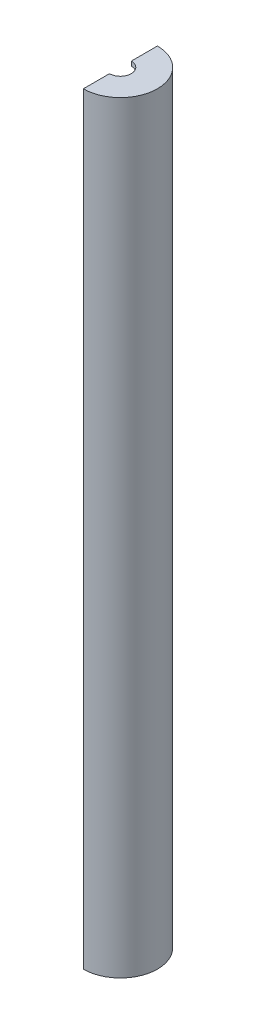
from build123d import *

# Parameters (mm, degrees)
EXTRUDE_1_DEPTH = 350
EXTRUDE_START   = -2
EXTRUDE_2_DEPTH = 2
EXTRUDE_3_DEPTH = 2


with BuildPart() as part:
    # 草图1 → 凸台-拉伸1 (new body)
    with BuildSketch(Plane(origin=(0, 0, 0), x_dir=(1, 0, 0), z_dir=(0, 1, 0))):
        with BuildLine():
            Line((0, 17), (0, 15))
            ThreePointArc((0, 15), (15, 0), (0, -15))
            Line((0, -15), (0, -17))
            ThreePointArc((0, -17), (17, 0), (0, 17))
        make_face()
    extrude(amount=EXTRUDE_1_DEPTH)

    # 草图2 → 凸台-拉伸2 (add)
    with BuildSketch(Plane(origin=(0, 350, 0), x_dir=(1, 0, 0), z_dir=(0, 1, 0)).offset(EXTRUDE_START)):
        with BuildLine():
            Line((0, 17), (0, 5))
            ThreePointArc((0, 5), (5, 0), (0, -5))
            Line((0, -5), (0, -17))
            ThreePointArc((0, -17), (17, 0), (0, 17))
        make_face()
    extrude(amount=EXTRUDE_2_DEPTH)

    # 草图3 → 凸台-拉伸3 (add)
    with BuildSketch(Plane.XZ):
        with BuildLine():
            Line((0, 17), (0, 5))
            ThreePointArc((0, 5), (5, 0), (0, -5))
            Line((0, -5), (0, -17))
            ThreePointArc((0, -17), (17, 0), (0, 17))
        make_face()
    extrude(amount=-EXTRUDE_3_DEPTH)


solid = part.part
